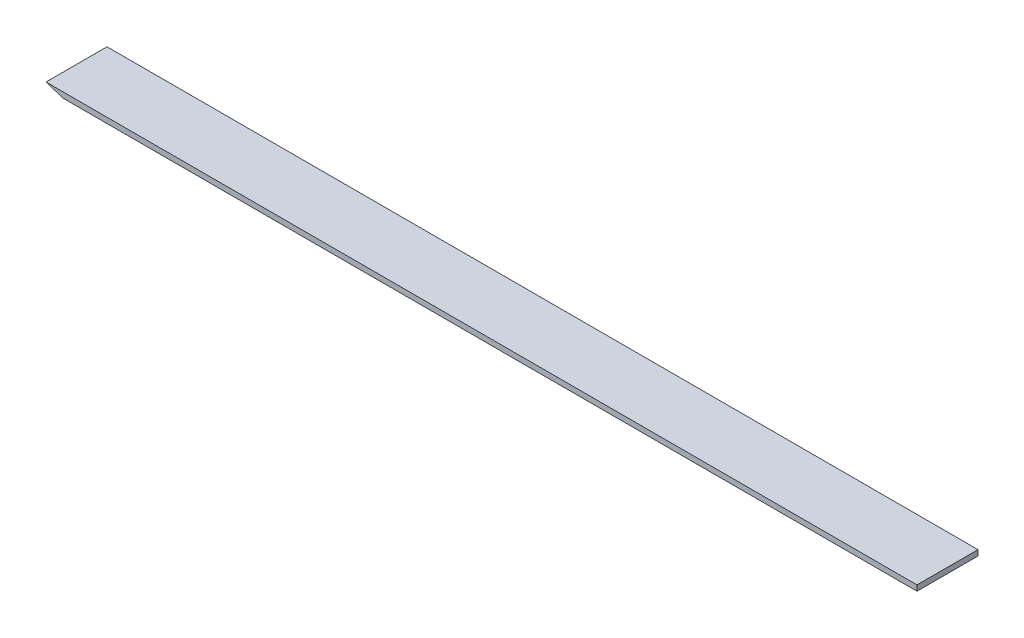
from build123d import *

# Parameters (mm, degrees)
BOSS_EXTRUDE1_DEPTH = 100


with BuildPart() as part:
    # Sketch1 → Boss-Extrude1 (new body)
    with BuildSketch(Plane.XY):
        Polygon((0, 0), (1428, 0), (1428, -9), (28, -9), align=None)
    extrude(amount=BOSS_EXTRUDE1_DEPTH)


solid = part.part
